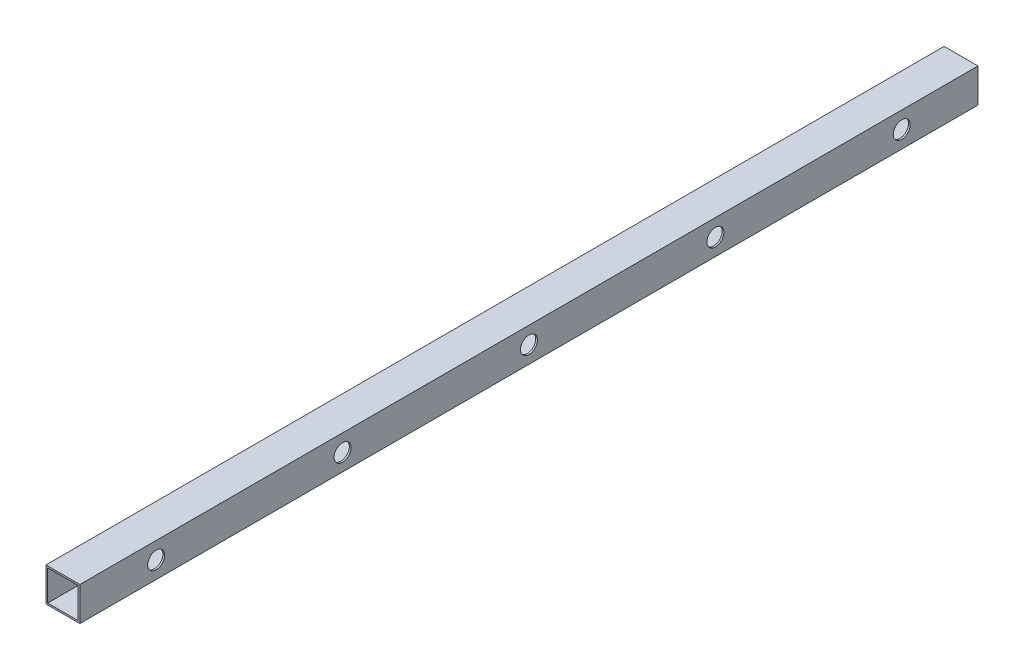
from build123d import *

# Parameters (mm, degrees)
CROQUIS1_W            = 40
CROQUIS1_H            = 40
CROQUIS1_W_2          = 36
CROQUIS1_H_2          = 36
EXTRUIR_L_MINA1_DEPTH = 1060
CROQUIS2_R            = 10
EXTRUIR1_DEPTH        = 10


with BuildPart() as part:
    # Croquis1 → Extruir-Lámina1 (new body)
    with BuildSketch(Plane.XY):
        Rectangle(CROQUIS1_W, CROQUIS1_H)
        Rectangle(CROQUIS1_W_2, CROQUIS1_H_2, mode=Mode.SUBTRACT)
    extrude(amount=EXTRUIR_L_MINA1_DEPTH)

    # Croquis2 → Extruir1 (cut)
    with BuildSketch(Plane(origin=(20, 0, 0), x_dir=(0, 0, -1), z_dir=(1, 0, 0))):
        with Locations((-530, 0)):
            Circle(CROQUIS2_R)
        with Locations((-310, 0)):
            Circle(CROQUIS2_R)
        with Locations((-90, 0)):
            Circle(CROQUIS2_R)
        with Locations((-750, 0)):
            Circle(CROQUIS2_R)
        with Locations((-970, 0)):
            Circle(CROQUIS2_R)
    extrude(amount=-EXTRUIR1_DEPTH, mode=Mode.SUBTRACT)


solid = part.part
